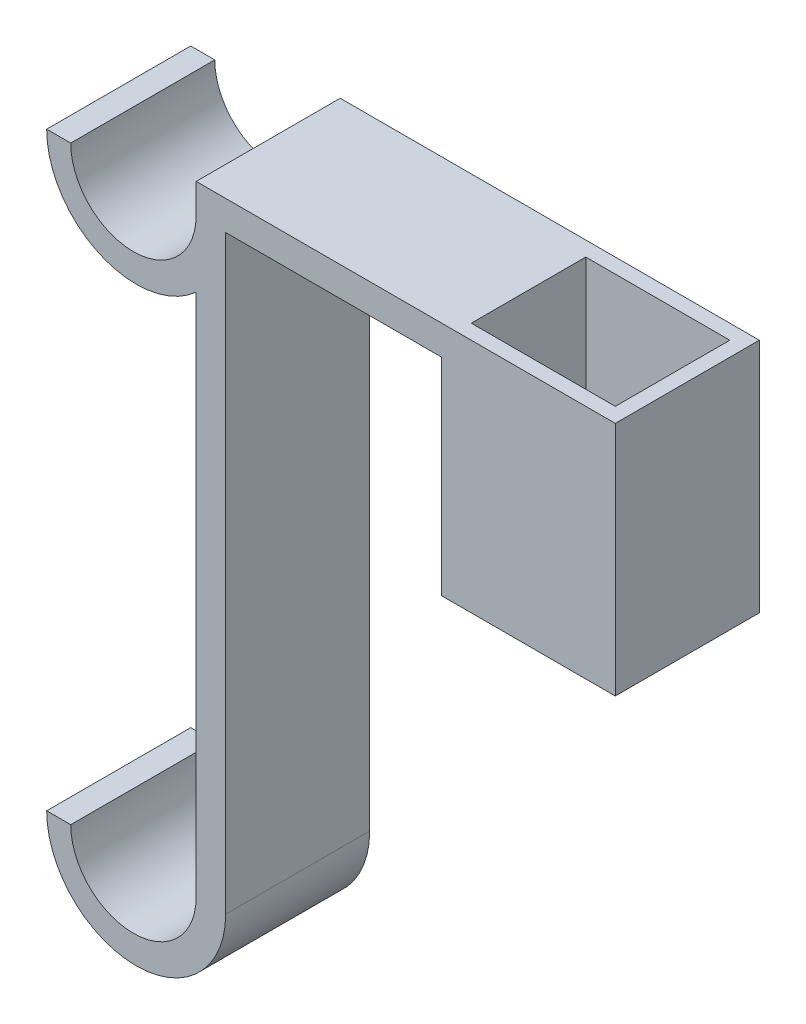
from build123d import *

# Parameters (mm, degrees)
SKETCH2_W               = 29.4
SKETCH2_H               = 24.4
BOSS_EXTRUDE1_DEPTH     = 35
SKETCH4_W               = 71
SKETCH4_H               = 24.4
BOSS_EXTRUDE2_DEPTH     = 5
SKETCH5_W               = 5
SKETCH5_H               = 100
BOSS_EXTRUDE3_DEPTH     = 24.4
BOSS_EXTRUDE5_DEPTH     = 24.4
CUT_EXTRUDE1_DEPTH      = 116.054406213
CUT_EXTRUDE1_DEPTH_BACK = 116.054406213
SKETCH3_W               = 24.4
SKETCH3_H               = 19.4


with BuildPart() as part:
    # Sketch2 → Boss-Extrude1 (new body)
    with BuildSketch(Plane(origin=(0, 0, 0), x_dir=(1, 0, 0), z_dir=(0, 1, 0))):
        Rectangle(SKETCH2_W, SKETCH2_H)
    extrude(amount=BOSS_EXTRUDE1_DEPTH)

    # Sketch4 → Boss-Extrude2 (add)
    with BuildSketch(Plane(origin=(0, 35, 0), x_dir=(1, 0, 0), z_dir=(0, 1, 0))):
        with Locations((-20.8, 0)):
            Rectangle(SKETCH4_W, SKETCH4_H)
    extrude(amount=BOSS_EXTRUDE2_DEPTH)

    # Sketch5 → Boss-Extrude3 (add)
    with BuildSketch(Plane.XY.offset(12.2)):
        with Locations((-53.8, -15)):
            Rectangle(SKETCH5_W, SKETCH5_H)
    extrude(amount=-BOSS_EXTRUDE3_DEPTH)

    # Sketch7 → Boss-Extrude5 (add)
    with BuildSketch(Plane.XY.offset(12.2)):
        with BuildLine():
            Line((-51.3, -65), (-56.3, -65))
            ThreePointArc((-56.3, -65), (-66.925596508, -75.625596508), (-77.551193015, -65))
            Line((-77.551193015, -65), (-81.625038444, -65))
            ThreePointArc((-81.625038444, -65), (-66.462519222, -80.162519222), (-51.3, -65))
        make_face()
        with BuildLine():
            Line((-81.625038444, 35), (-77.551193015, 35))
            ThreePointArc((-77.551193015, 35), (-66.925596508, 24.374403492), (-56.3, 35))
            Line((-56.3, 35), (-51.3, 35))
            ThreePointArc((-51.3, 35), (-66.462519222, 19.837480778), (-81.625038444, 35))
        make_face()
    extrude(amount=-BOSS_EXTRUDE5_DEPTH)

    # Sketch3 → Cut-Extrude1 (cut, two sides: drawn at the far end of the back side and taken through both)
    with BuildSketch(Plane.XZ.offset(-CUT_EXTRUDE1_DEPTH_BACK)):
        Rectangle(SKETCH3_W, SKETCH3_H)
    extrude(amount=CUT_EXTRUDE1_DEPTH + CUT_EXTRUDE1_DEPTH_BACK, mode=Mode.SUBTRACT)


solid = part.part
